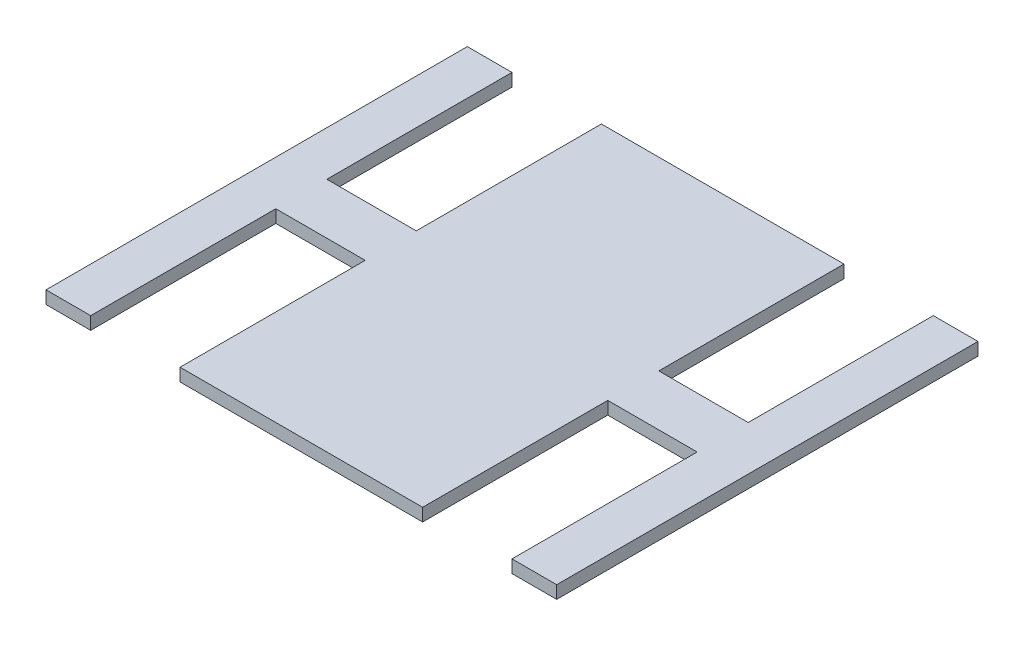
from build123d import *

# Parameters (mm, degrees)
AUFSATZ_LINEAR_AUSTRAGEN1_DEPTH = 10


with BuildPart() as part:
    # Skizze1 → Aufsatz-Linear austragen1 (new body)
    with BuildSketch(Plane(origin=(0, 0, 0), x_dir=(1, 0, 0), z_dir=(0, 1, 0))):
        Polygon((-200, 165), (-200, -165), (-165, -165), (-165, -20), (-95, -20), (-95, -165), (95, -165), (95, -20), (165, -20), (165, -165), (200, -165), (200, 165), (165, 165), (165, 20), (95, 20), (95, 165), (-95, 165), (-95, 20), (-165, 20), (-165, 165), align=None)
    extrude(amount=AUFSATZ_LINEAR_AUSTRAGEN1_DEPTH)


solid = part.part
